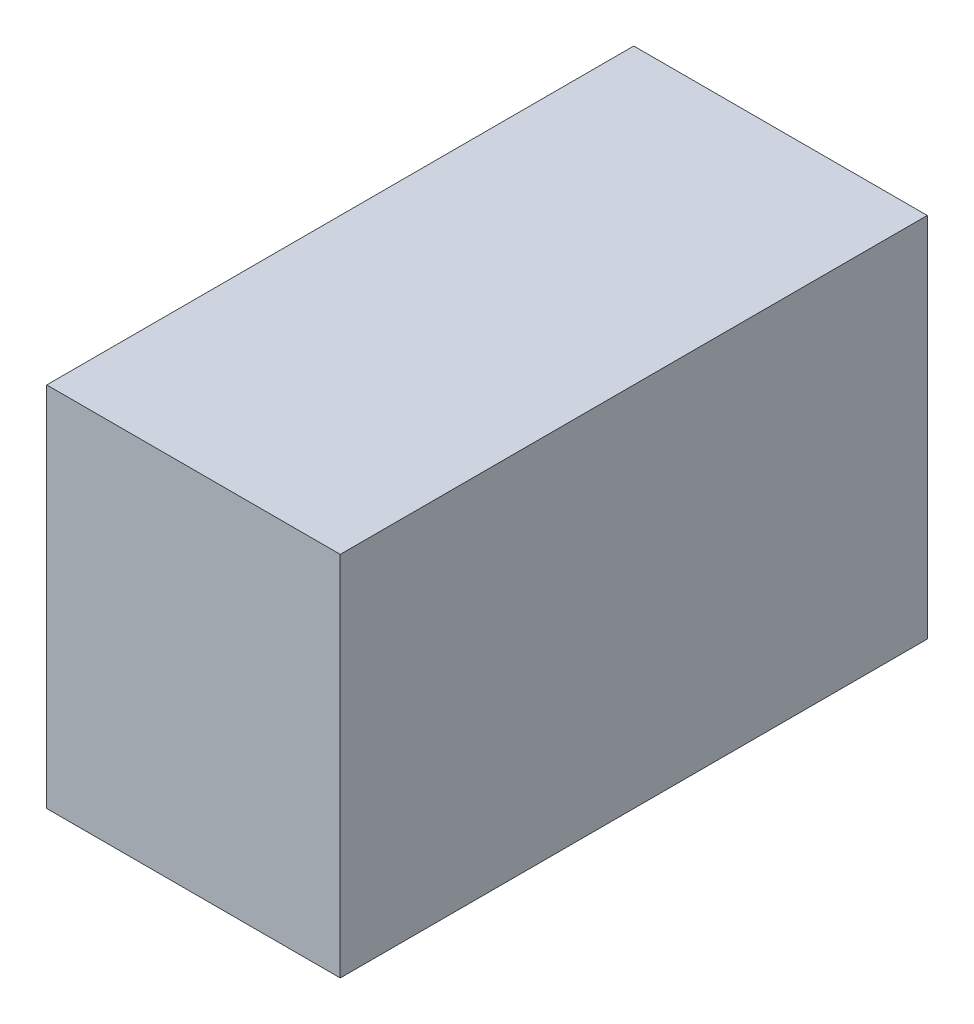
from build123d import *

# Parameters (mm, degrees)
SKETCH1_W           = 203.2
SKETCH1_H           = 254
BOSS_EXTRUDE1_DEPTH = 406.4


with BuildPart() as part:
    # Sketch1 → Boss-Extrude1 (new body)
    with BuildSketch(Plane.XY):
        Rectangle(SKETCH1_W, SKETCH1_H)
    extrude(amount=BOSS_EXTRUDE1_DEPTH)


solid = part.part
